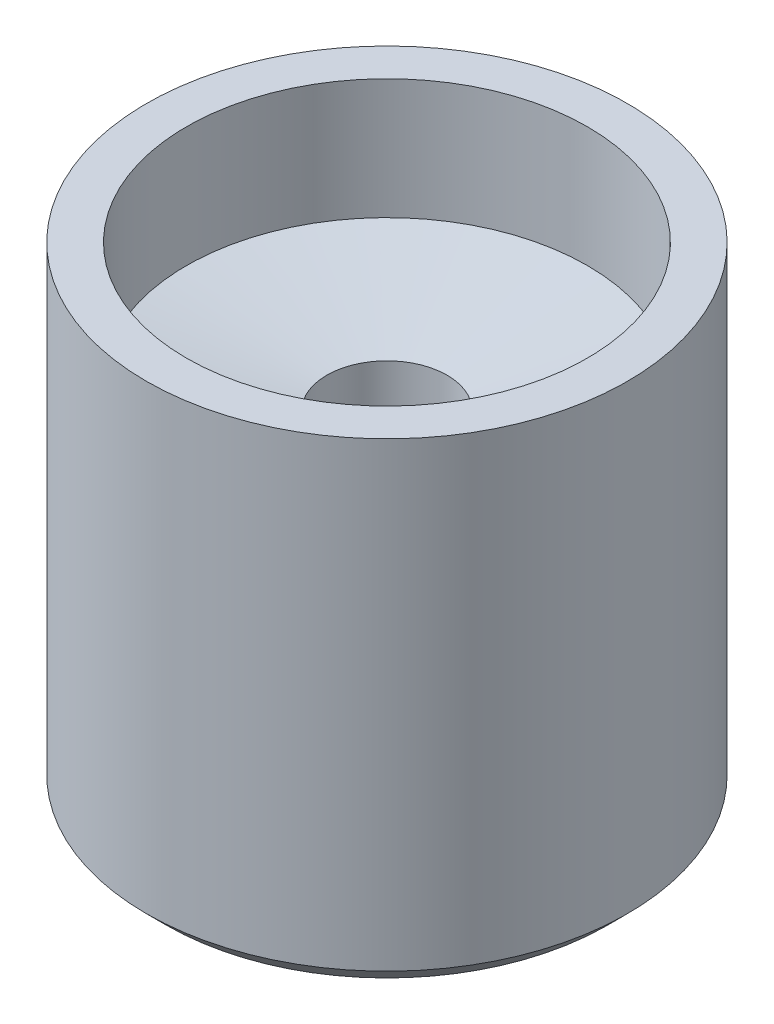
from build123d import *

# Parameters (mm, degrees)
SKETCH1_R           = 6
BOSS_EXTRUDE1_DEPTH = 12
SKETCH2_R           = 5
CUT_EXTRUDE1_DEPTH  = 3
CHAMFER1_SIZE       = 0.5


with BuildPart() as part:
    # Sketch1 → Boss-Extrude1 (new body)
    with BuildSketch(Plane(origin=(0, 0, 0), x_dir=(1, 0, 0), z_dir=(0, 1, 0))):
        with Locations(Location((0, 0, 0), (0, 0, 270))):
            Circle(SKETCH1_R)
    extrude(amount=BOSS_EXTRUDE1_DEPTH)

    # Sketch2 → Cut-Extrude1 (cut)
    with BuildSketch(Plane(origin=(0, 12, 0), x_dir=(1, 0, 0), z_dir=(0, 1, 0))):
        with Locations(Location((0, 0, 0), (0, 0, 270))):
            Circle(SKETCH2_R)
    extrude(amount=-CUT_EXTRUDE1_DEPTH, mode=Mode.SUBTRACT)

    # Sketch3 → Cut-Revolve1 (revolve, cut)
    with BuildSketch(Plane.XY, mode=Mode.PRIVATE) as cut_revolve1_sk:
        Polygon((-5, 9), (-1.5, 8.382855568), (-1.5, 3.5), (0, 3.5), (0, 9), align=None)
    revolve(cut_revolve1_sk.sketch.rotate(Axis((0, 3.5, 0), (0, 1, 0)), 90), axis=Axis((0, 3.5, 0), (0, 1, 0)), mode=Mode.SUBTRACT)

    # Chamfer1
    chamfer1_edges = [part.edges().sort_by_distance(p)[0] for p in [
        (0, 0, -6),
    ]]
    chamfer(chamfer1_edges, length=CHAMFER1_SIZE)


solid = part.part
